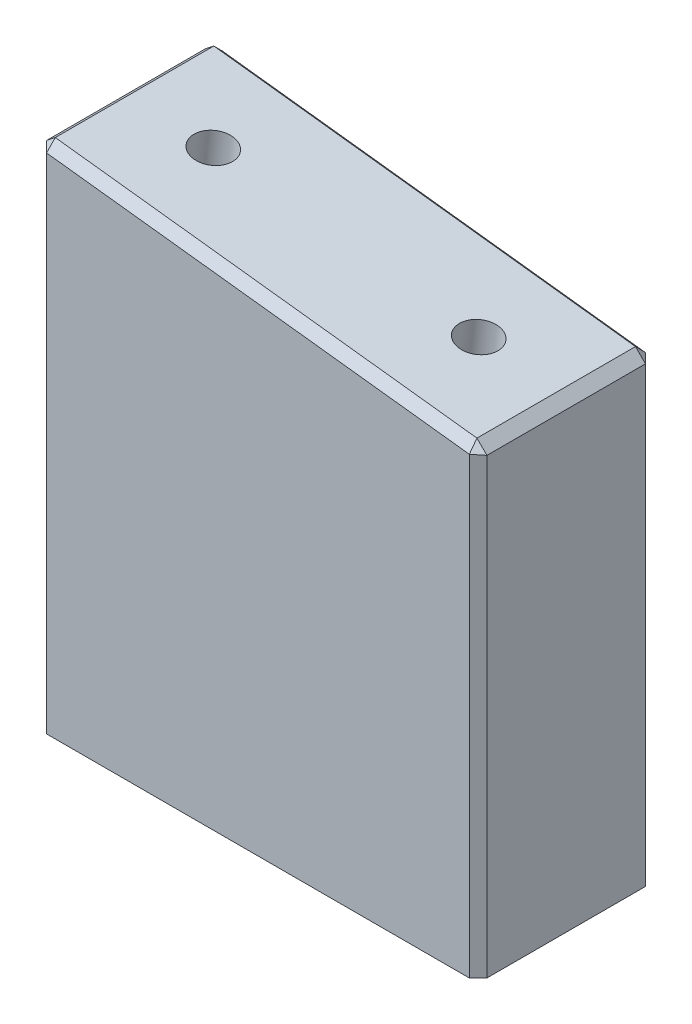
from build123d import *
from OCP.BRepFilletAPI import BRepFilletAPI_MakeChamfer

# Parameters (mm, degrees)
BOSS_EXTRUDE1_DEPTH = 20
SKETCH3_W           = 42.34282297
SKETCH3_H           = 14
CUT_EXTRUDE1_DEPTH  = 10
CUT_EXTRUDE2_DEPTH  = 14
SKETCH2_R           = 2.2
CUT_EXTRUDE3_DEPTH  = 6
CHAMFER1_SIZE       = 1
CHAMFER1_SIZE2      = 0.9011492
CHAMFER1_SIZE2_2    = 1.140658854


with BuildPart() as part:
    # Sketch1 → Boss-Extrude1 (new body)
    with BuildSketch(Plane.XY):
        Polygon((0, 58.251961434), (0, 0), (50, 0), (50, 52.38682507), align=None)
    extrude(amount=BOSS_EXTRUDE1_DEPTH)

    # Sketch3 → Cut-Extrude1 (cut)
    with BuildSketch(Plane(origin=(6.041343432, 51.502156617, 0), x_dir=(0.9931902315046269, -0.11650392286865593, 0), z_dir=(0.11650392286865592, 0.9931902315046268, 0))):
        with Locations((18.384829463, -10)):
            Rectangle(SKETCH3_W, SKETCH3_H)
    extrude(amount=-CUT_EXTRUDE1_DEPTH, mode=Mode.SUBTRACT)

    # Sketch4 → Cut-Extrude2 (cut)
    with BuildSketch(Plane.XY.offset(3)):
        Polygon((2.10869816, 41.894902039), (2.10869816, 0), (44.163176308, 0), (44.163176308, 36.961797057), align=None)
    extrude(amount=CUT_EXTRUDE2_DEPTH, mode=Mode.SUBTRACT)

    # Sketch2 → Cut-Extrude3 (cut)
    with BuildSketch(Plane(origin=(6.740366969, 57.461298006, 0), x_dir=(0.9931902315046269, -0.11650392286865593, 0), z_dir=(0.11650392286865592, 0.9931902315046268, 0))):
        with Locations(Location((3.213417978, -10, 0), (0, 0, 180))):
            Circle(SKETCH2_R)
        with Locations(Location((33.556240948, -10, 0), (0, 0, 180))):
            Circle(SKETCH2_R)
    extrude(amount=-CUT_EXTRUDE3_DEPTH, mode=Mode.SUBTRACT)

    # Chamfer1: one chamfer whose edges measure the first distance from different faces: ONE call of the kernel's chamfer builder (chamfer() names one face for all edges)
    chamfer1_edges_1 = [part.edges().sort_by_distance(p)[0] for p in [
        (25, 55.319393252, 20),
        (0, 29.125980717, 20),
        (0, 29.125980717, 0),
        (25, 55.319393252, 0),
        (50, 26.193412535, 0),
        (50, 26.193412535, 20),
    ]]
    chamfer1_edges_2 = [part.edges().sort_by_distance(p)[0] for p in [
        (0, 58.251961434, 10),
    ]]
    chamfer1_side_2 = [part.faces().sort_by_distance(p)[0] for p in [
        (25, 55.319393252, 10),
    ]]
    chamfer1_edges_3 = [part.edges().sort_by_distance(p)[0] for p in [
        (50, 52.38682507, 10),
    ]]
    chamfer1_side_3 = [part.faces().sort_by_distance(p)[0] for p in [
        (50, 26.193412535, 10),
    ]]
    chamfer1 = BRepFilletAPI_MakeChamfer(part.part.solid().wrapped)
    for e in chamfer1_edges_1:
        chamfer1.Add(CHAMFER1_SIZE, e.wrapped)
    for e in chamfer1_edges_2:
        chamfer1.Add(CHAMFER1_SIZE, CHAMFER1_SIZE2, e.wrapped, chamfer1_side_2[0].wrapped)  # the first distance lies on this face
    for e in chamfer1_edges_3:
        chamfer1.Add(CHAMFER1_SIZE, CHAMFER1_SIZE2_2, e.wrapped, chamfer1_side_3[0].wrapped)  # the first distance lies on this face
    add(Compound.cast(chamfer1.Shape()), mode=Mode.REPLACE)


solid = part.part
